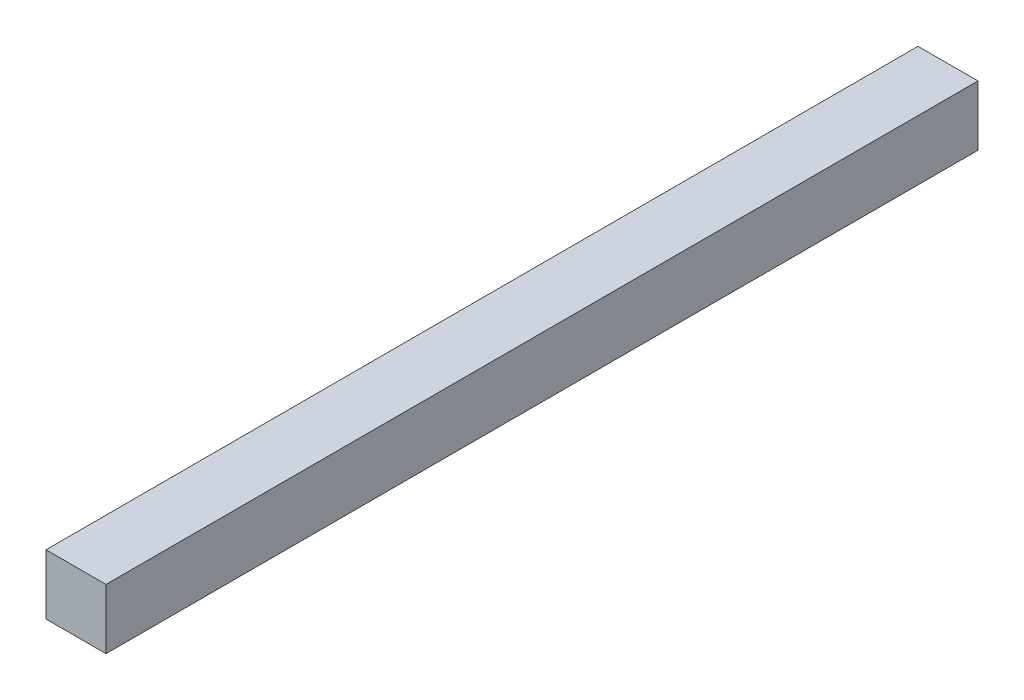
from build123d import *

# Parameters (mm, degrees)
SKETCH1_W           = 30
SKETCH1_H           = 30
BOSS_EXTRUDE1_DEPTH = 436


with BuildPart() as part:
    # Sketch1 → Boss-Extrude1 (new body)
    with BuildSketch(Plane.XY):
        with Locations((-4.576235094, 7.717206133)):
            Rectangle(SKETCH1_W, SKETCH1_H)
    extrude(amount=BOSS_EXTRUDE1_DEPTH)


solid = part.part
